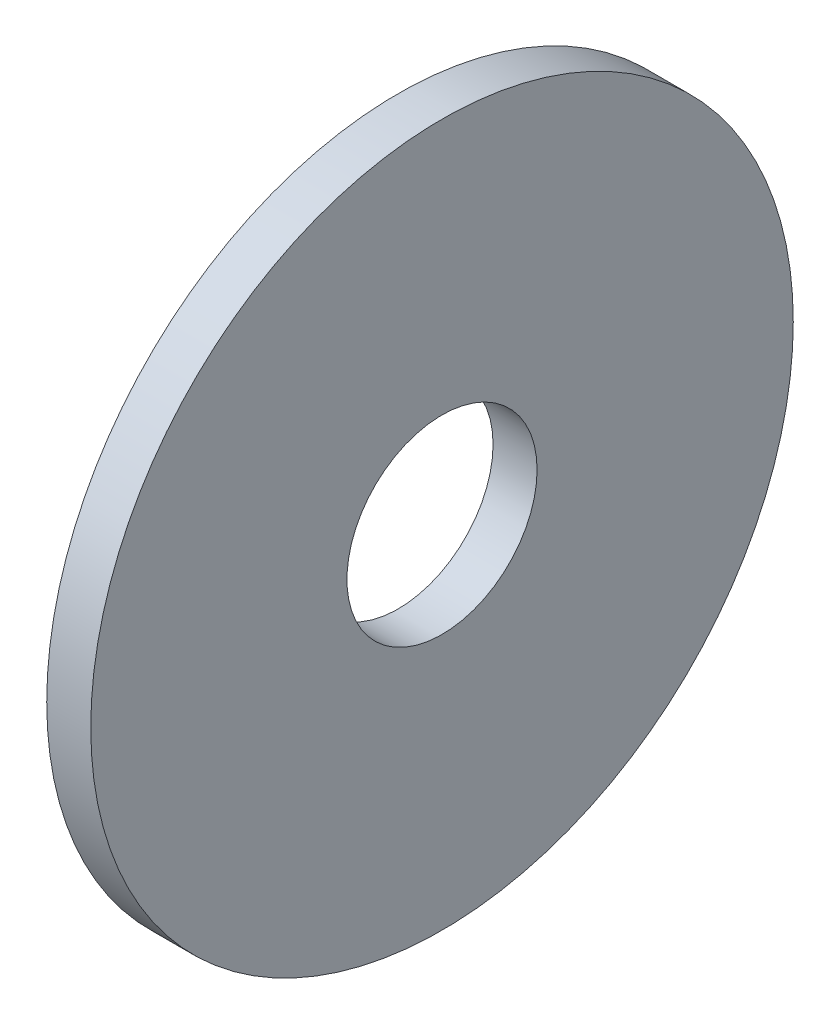
from build123d import *

# Parameters (mm, degrees)
SKETCH1_R           = 9.525
SKETCH1_R_2         = 2.5781
BOSS_EXTRUDE1_DEPTH = 1.1938


with BuildPart() as part:
    # Sketch1 → Boss-Extrude1 (new body)
    with BuildSketch(Plane(origin=(0, 0, 0), x_dir=(0, 0, -1), z_dir=(1, 0, 0))):
        Circle(SKETCH1_R)
        Circle(SKETCH1_R_2, mode=Mode.SUBTRACT)
    extrude(amount=BOSS_EXTRUDE1_DEPTH)


solid = part.part
